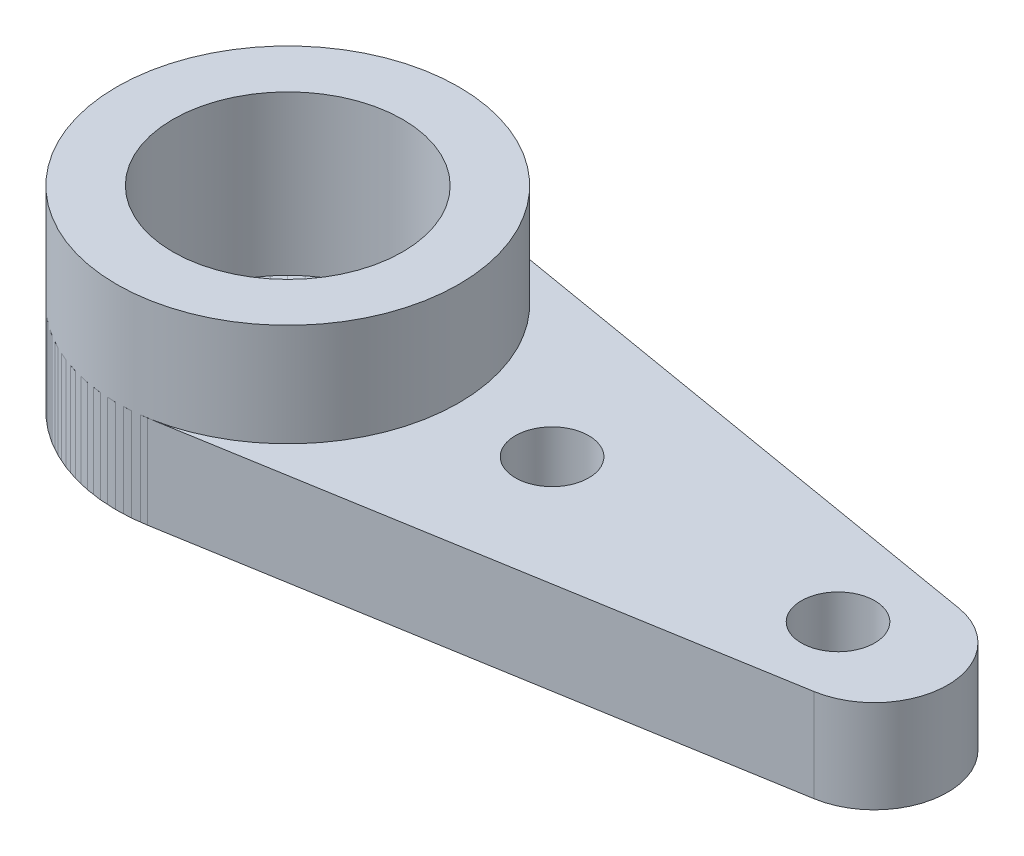
from build123d import *

# Parameters (mm, degrees)
SKETCH1_R           = 3.5
SKETCH1_R_2         = 1.5
BOSS_EXTRUDE1_DEPTH = 4
SKETCH2_R           = 1.5
BOSS_EXTRUDE2_DEPTH = 1.9
SKETCH3_R           = 2.35
CUT_EXTRUDE1_DEPTH  = 3.25
SKETCH5_R           = 0.75
CUT_EXTRUDE2_DEPTH  = 15.508618129


with BuildPart() as part:
    # Sketch1 → Boss-Extrude1 (new body)
    with BuildSketch(Plane(origin=(0, 0, 0), x_dir=(1, 0, 0), z_dir=(0, 1, 0))):
        with Locations(Location((0, 0, 0), (0, 0, 270))):
            Circle(SKETCH1_R)
        with Locations(Location((0, 0, 0), (0, 0, 270))):
            Circle(SKETCH1_R_2, mode=Mode.SUBTRACT)
    extrude(amount=BOSS_EXTRUDE1_DEPTH)


with BuildPart() as body_2:
    # Sketch2 → Boss-Extrude2 (new body)
    with BuildSketch(Plane.XZ):
        with BuildLine():
            Line((0.583333333, 3.45104654), (12.25, 1.479019946))
            ThreePointArc((12.25, 1.479019946), (13.5, 0), (12.25, -1.479019946))
            Line((12.25, -1.479019946), (0.583333333, -3.45104654))
            ThreePointArc((0.583333333, -3.45104654), (-3.5, 0), (0.583333333, 3.45104654))
        make_face()
        with Locations(Location((0, 0, 0), (0, 0, 270))):
            Circle(SKETCH2_R, mode=Mode.SUBTRACT)
    extrude(amount=-BOSS_EXTRUDE2_DEPTH)


with BuildPart() as cut_extrude1_tool:
    # Sketch3 → Cut-Extrude1 (new body)
    with BuildSketch(Plane(origin=(0, 4, 0), x_dir=(1, 0, 0), z_dir=(0, 1, 0))):
        with Locations(Location((0, 0, 0), (0, 0, 270))):
            Circle(SKETCH3_R)
    extrude(amount=-CUT_EXTRUDE1_DEPTH)


with BuildPart() as part_1:
    add(part.part)

    # Cut-Extrude1: cut by cut_extrude1_tool
    add(cut_extrude1_tool.part, mode=Mode.SUBTRACT)


with BuildPart() as body_2_1:
    add(body_2.part)

    # Cut-Extrude1: cut by cut_extrude1_tool
    add(cut_extrude1_tool.part, mode=Mode.SUBTRACT)

    # Sketch5 → Cut-Extrude2 (cut, through all)
    with BuildSketch(Plane.XZ):
        with Locations(Location((11.257592571, 0, 0), (0, 0, 270))):
            Circle(SKETCH5_R)
        with Locations(Location((5.407592571, 0, 0), (0, 0, 270))):
            Circle(SKETCH5_R)
    extrude(amount=-CUT_EXTRUDE2_DEPTH, mode=Mode.SUBTRACT)


solid = Compound([part_1.part, body_2_1.part])
